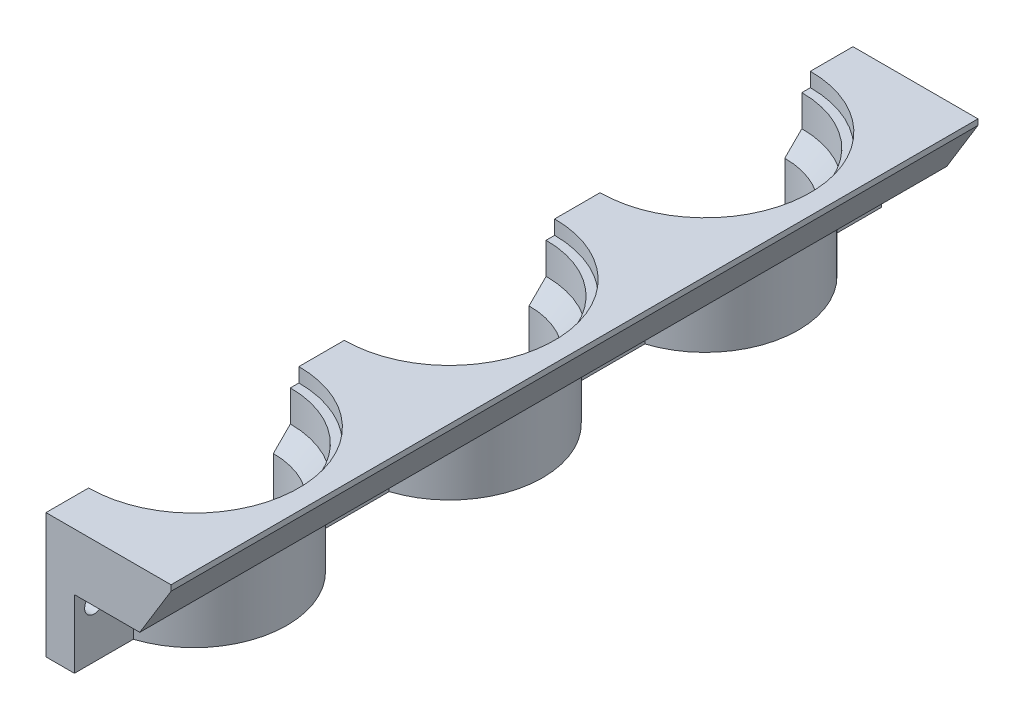
from build123d import *

# Parameters (mm, degrees)
BOSS_EXTRUDE1_DEPTH = 10
BOSS_EXTRUDE2_DEPTH = 12
CHAMFER2_SIZE       = 5.5
CHAMFER2_SIZE2      = 9
SKETCH6_W           = 14
SKETCH6_H           = 15
SKETCH6_W_2         = 17
SKETCH6_H_2         = 2.5
SKETCH6_W_3         = 1.5
LPATTERN3_COUNT     = 3
LPATTERN3_PITCH     = 45
SKETCH7_R           = 1.7
CUT_EXTRUDE1_DEPTH  = 10
LPATTERN4_COUNT     = 3
LPATTERN4_PITCH     = 45
LPATTERN5_COUNT     = 2
LPATTERN5_PITCH     = 45


with BuildPart() as part:
    # Sketch1 → Boss-Extrude1 (new body)
    with BuildSketch(Plane(origin=(0, 0, 0), x_dir=(1, 0, 0), z_dir=(0, 1, 0))):
        with BuildLine():
            Line((0, -11.4), (0, -26))
            Line((0, -26), (22, -26))
            Line((22, -26), (22, 116))
            Line((22, 116), (0, 116))
            Line((0, 116), (0, 101.4))
            ThreePointArc((0, 101.4), (11.4, 90), (0, 78.6))
            Line((0, 78.6), (0, 56.4))
            ThreePointArc((0, 56.4), (11.4, 45), (0, 33.6))
            Line((0, 33.6), (0, 11.4))
            ThreePointArc((0, 11.4), (11.4, 0), (0, -11.4))
        make_face()
    extrude(amount=-BOSS_EXTRUDE1_DEPTH)

    # Sketch3 → Boss-Extrude2 (add)
    with BuildSketch(Plane.XZ.offset(10)):
        with BuildLine():
            Line((0, -116), (0, -101.4))
            ThreePointArc((0, -101.4), (11.4, -90), (0, -78.6))
            Line((0, -78.6), (0, -56.4))
            ThreePointArc((0, -56.4), (11.4, -45), (0, -33.6))
            Line((0, -33.6), (0, -11.4))
            ThreePointArc((0, -11.4), (11.4, 0), (0, 11.4))
            Line((0, 11.4), (0, 26))
            Line((0, 26), (5, 26))
            Line((5, 26), (5, 15.619218931))
            ThreePointArc((5, 15.619218931), (16.4, 0), (5, -15.619218931))
            Line((5, -15.619218931), (5, -29.380781069))
            ThreePointArc((5, -29.380781069), (16.4, -45), (5, -60.619218931))
            Line((5, -60.619218931), (5, -74.380781069))
            ThreePointArc((5, -74.380781069), (16.4, -90), (5, -105.619218931))
            Line((5, -105.619218931), (5, -116))
            Line((5, -116), (0, -116))
        make_face()
    extrude(amount=BOSS_EXTRUDE2_DEPTH)

    # Chamfer2
    chamfer2_edges = [part.edges().sort_by_distance(p)[0] for p in [
        (22, -10, -45),
    ]]
    chamfer2_side = [part.faces().sort_by_distance(p)[0] for p in [
        (6.430139853, -10, 20.809609465),
    ]]
    chamfer(chamfer2_edges, length=CHAMFER2_SIZE, length2=CHAMFER2_SIZE2, reference=chamfer2_side[0])

    # Sketch6 → Cut-Revolve6 (revolve, cut)
    with BuildSketch(Plane.ZY):
        with Locations((-83, -18.5)):
            Rectangle(SKETCH6_W, SKETCH6_H)
        Polygon((-90, -11), (-76, -11), (-73, -8), (-73, -2.5), (-90, -2.5), align=None)
        with Locations((-81.5, -1.25)):
            Rectangle(SKETCH6_W_2, SKETCH6_H_2)
        with Locations((-72.25, -1.25)):
            Rectangle(SKETCH6_W_3, SKETCH6_H_2)
    cut_revolve6 = revolve(axis=Axis((0, 0, -90), (0, -1, 0)), mode=Mode.SUBTRACT)

    # LPattern3: Cut-Revolve6 ×3
    with Locations(*[(0, 0, i * LPATTERN3_PITCH) for i in range(1, LPATTERN3_COUNT)]):
        add(cut_revolve6, mode=Mode.SUBTRACT)

    # Sketch7 → Cut-Extrude1 (cut)
    with BuildSketch(Plane(origin=(5, 0, 0), x_dir=(0, 0, -1), z_dir=(1, 0, 0))):
        with Locations((67.5, -13)):
            Circle(SKETCH7_R)
    cut_extrude1 = extrude(amount=-CUT_EXTRUDE1_DEPTH, mode=Mode.SUBTRACT)

    # LPattern4: Cut-Extrude1 ×3
    with Locations(*[(0, 0, i * LPATTERN4_PITCH) for i in range(1, LPATTERN4_COUNT)]):
        add(cut_extrude1, mode=Mode.SUBTRACT)

    # LPattern5: Cut-Extrude1 ×2
    with Locations(*[(0, 0, -i * LPATTERN5_PITCH) for i in range(1, LPATTERN5_COUNT)]):
        add(cut_extrude1, mode=Mode.SUBTRACT)


solid = part.part
